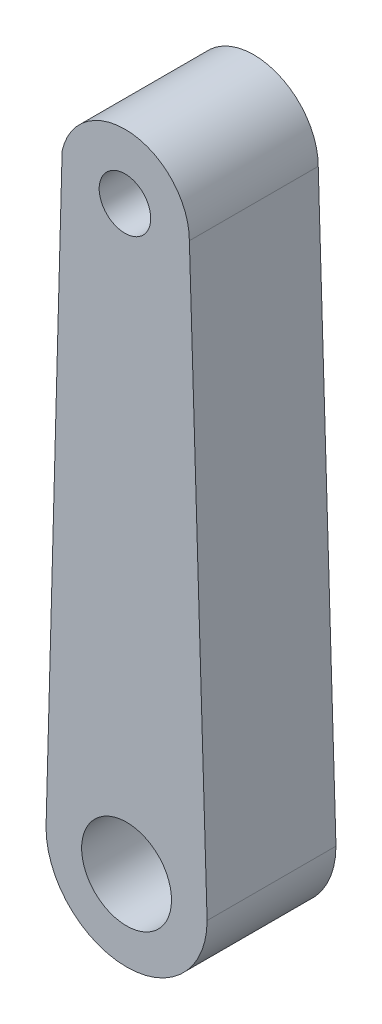
from build123d import *

# Parameters (mm, degrees)
EXTRUDE1_DEPTH     = 10
SKETCH6_R          = 4
CUT_EXTRUDE1_DEPTH = 103.743268025
SKETCH8_R          = 6.975
CUT_EXTRUDE2_DEPTH = 103.743268025


with BuildPart() as part:
    # Sketch2 → Extrude1 (new, symmetric)
    with BuildSketch(Plane.XY):
        with BuildLine():
            Line((-12.5, 0), (-10, 92.232909937))
            ThreePointArc((-10, 92.232909937), (0.871187265, 99.936304296), (9.747437125, 89.999645621))
            Line((9.747437125, 89.999645621), (12.5, 0))
            ThreePointArc((12.5, 0), (0, -12.5), (-12.5, 0))
        make_face()
    extrude(amount=EXTRUDE1_DEPTH, both=True)

    # Sketch6 → Cut-Extrude1 (cut, through all)
    with BuildSketch(Plane.XY.offset(10)):
        with Locations((-0.252562875, 89.999645621)):
            Circle(SKETCH6_R)
    extrude(amount=-CUT_EXTRUDE1_DEPTH, mode=Mode.SUBTRACT)

    # Sketch8 → Cut-Extrude2 (cut, through all)
    with BuildSketch(Plane.XY.offset(10)):
        Circle(SKETCH8_R)
    extrude(amount=-CUT_EXTRUDE2_DEPTH, mode=Mode.SUBTRACT)


solid = part.part
